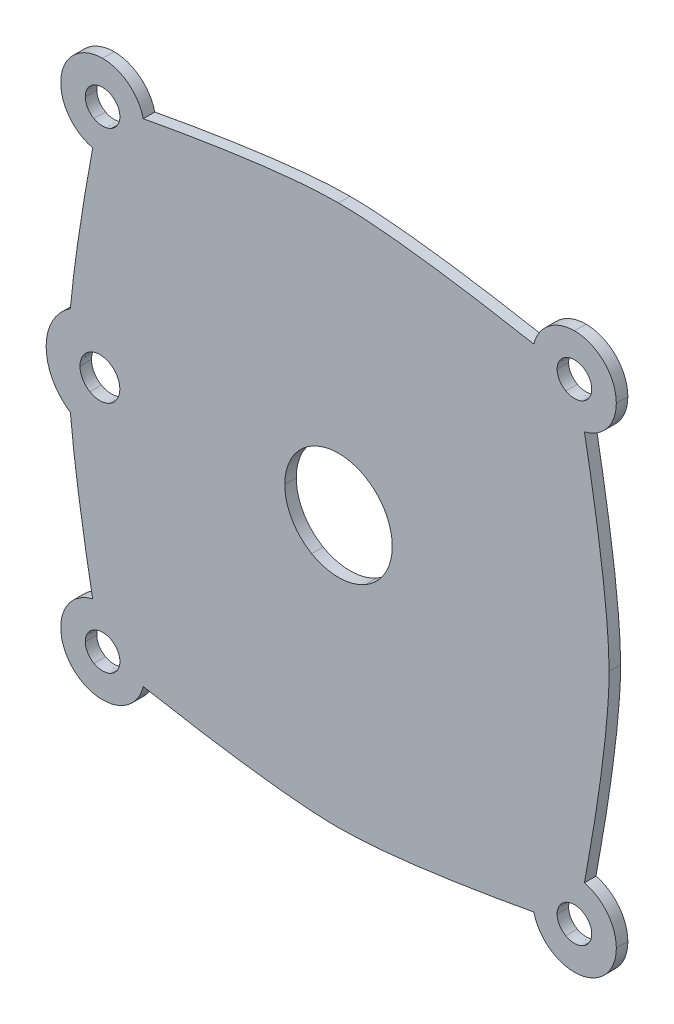
from build123d import *

# Parameters (mm, degrees)
BOSS_EXTRUDE1_DEPTH = 1.5875


with BuildPart() as part:
    # Model → Boss-Extrude1 (new body)
    with BuildSketch(Plane.XY):
        with BuildLine():
            add(Edge.make_bspline(
                [(51.355625, 215.675903), (48.170397, 215.675903), (45.587708, 213.093214), (45.587708, 209.907986)],
                knots=[0, 0, 0, 0, 1, 1, 1, 1], degree=3))
            add(Edge.make_bspline(
                [(45.587708, 209.907986), (45.587708, 207.192636), (47.461661, 204.920366), (49.988611, 204.307639)],
                knots=[0, 0, 0, 0, 1, 1, 1, 1], degree=3))
            add(Edge.make_bspline(
                [(49.988611, 204.307639), (48.973952, 198.860581), (47.546613, 190.540568), (46.910625, 183.581944)],
                knots=[0, 0, 0, 0, 1, 1, 1, 1], degree=3))
            add(Edge.make_bspline(
                [(46.910625, 183.581944), (44.902013, 182.25747), (43.576875, 179.985474), (43.576875, 177.399514)],
                knots=[0, 0, 0, 0, 1, 1, 1, 1], degree=3))
            add(Edge.make_bspline(
                [(43.576875, 177.399514), (43.576875, 174.813554), (44.902013, 172.532738), (46.910625, 171.208264)],
                knots=[0, 0, 0, 0, 1, 1, 1, 1], degree=3))
            add(Edge.make_bspline(
                [(46.910625, 171.208264), (47.544341, 164.25069), (48.96575, 155.940084), (49.979792, 150.491389)],
                knots=[0, 0, 0, 0, 1, 1, 1, 1], degree=3))
            add(Edge.make_bspline(
                [(49.979792, 150.491389), (47.456739, 149.875899), (45.587708, 147.603626), (45.587708, 144.891042)],
                knots=[0, 0, 0, 0, 1, 1, 1, 1], degree=3))
            add(Edge.make_bspline(
                [(45.587708, 144.891042), (45.587708, 141.705814), (48.170397, 139.123125), (51.355625, 139.123125)],
                knots=[0, 0, 0, 0, 1, 1, 1, 1], degree=3))
            add(Edge.make_bspline(
                [(51.355625, 139.123125), (54.06821, 139.123125), (56.340482, 140.992156), (56.955972, 143.515208)],
                knots=[0, 0, 0, 0, 1, 1, 1, 1], degree=3))
            add(Edge.make_bspline(
                [(56.955972, 143.515208), (64.168065, 142.172988), (76.405904, 140.119722), (83.864097, 140.119722)],
                knots=[0, 0, 0, 0, 1, 1, 1, 1], degree=3))
            add(Edge.make_bspline(
                [(83.864097, 140.119722), (91.322294, 140.119722), (103.560129, 142.172988), (110.772222, 143.515208)],
                knots=[0, 0, 0, 0, 1, 1, 1, 1], degree=3))
            add(Edge.make_bspline(
                [(110.772222, 143.515208), (111.387873, 140.992384), (113.660149, 139.123125), (116.372569, 139.123125)],
                knots=[0, 0, 0, 0, 1, 1, 1, 1], degree=3))
            add(Edge.make_bspline(
                [(116.372569, 139.123125), (119.557797, 139.123125), (122.140486, 141.705814), (122.140486, 144.891042)],
                knots=[0, 0, 0, 0, 1, 1, 1, 1], degree=3))
            add(Edge.make_bspline(
                [(122.140486, 144.891042), (122.140486, 147.601343), (120.268238, 149.87363), (117.748403, 150.491389)],
                knots=[0, 0, 0, 0, 1, 1, 1, 1], degree=3))
            add(Edge.make_bspline(
                [(117.748403, 150.491389), (119.090623, 157.703482), (121.143889, 169.941318), (121.143889, 177.399514)],
                knots=[0, 0, 0, 0, 1, 1, 1, 1], degree=3))
            add(Edge.make_bspline(
                [(121.143889, 177.399514), (121.143889, 184.85771), (119.090623, 197.095546), (117.748403, 204.307639)],
                knots=[0, 0, 0, 0, 1, 1, 1, 1], degree=3))
            add(Edge.make_bspline(
                [(117.748403, 204.307639), (120.268043, 204.925536), (122.140486, 207.197823), (122.140486, 209.907986)],
                knots=[0, 0, 0, 0, 1, 1, 1, 1], degree=3))
            add(Edge.make_bspline(
                [(122.140486, 209.907986), (122.140486, 213.093214), (119.557797, 215.675903), (116.372569, 215.675903)],
                knots=[0, 0, 0, 0, 1, 1, 1, 1], degree=3))
            add(Edge.make_bspline(
                [(116.372569, 215.675903), (113.662406, 215.675903), (111.39012, 213.80346), (110.772222, 211.283819)],
                knots=[0, 0, 0, 0, 1, 1, 1, 1], degree=3))
            add(Edge.make_bspline(
                [(110.772222, 211.283819), (103.560129, 212.62604), (91.322294, 214.679306), (83.864097, 214.679306)],
                knots=[0, 0, 0, 0, 1, 1, 1, 1], degree=3))
            add(Edge.make_bspline(
                [(83.864097, 214.679306), (76.404414, 214.679306), (64.16677, 212.618076), (56.955972, 211.275)],
                knots=[0, 0, 0, 0, 1, 1, 1, 1], degree=3))
            add(Edge.make_bspline(
                [(56.955972, 211.275), (56.341256, 213.799142), (54.068983, 215.675903), (51.355625, 215.675903)],
                knots=[0, 0, 0, 0, 1, 1, 1, 1], degree=3))
        make_face()
        with BuildLine():
            add(Edge.make_bspline(
                [(53.73559, 209.904656), (53.73559, 209.079821), (53.28086, 208.317642), (52.542694, 207.905225)],
                knots=[0, 0, 0, 0, 1, 1, 1, 1], degree=3))
            add(Edge.make_bspline(
                [(52.542694, 207.905225), (51.804528, 207.492808), (50.895069, 207.492808), (50.156903, 207.905225)],
                knots=[0, 0, 0, 0, 1, 1, 1, 1], degree=3))
            add(Edge.make_bspline(
                [(50.156903, 207.905225), (49.418737, 208.317642), (48.964008, 209.079821), (48.964008, 209.904656)],
                knots=[0, 0, 0, 0, 1, 1, 1, 1], degree=3))
            add(Edge.make_bspline(
                [(48.964008, 209.904656), (48.964008, 210.729491), (49.418737, 211.49167), (50.156903, 211.904087)],
                knots=[0, 0, 0, 0, 1, 1, 1, 1], degree=3))
            add(Edge.make_bspline(
                [(50.156903, 211.904087), (50.895069, 212.316505), (51.804528, 212.316505), (52.542694, 211.904087)],
                knots=[0, 0, 0, 0, 1, 1, 1, 1], degree=3))
            add(Edge.make_bspline(
                [(52.542694, 211.904087), (53.28086, 211.49167), (53.73559, 210.729491), (53.73559, 209.904656)],
                knots=[0, 0, 0, 0, 1, 1, 1, 1], degree=3))
        make_face(mode=Mode.SUBTRACT)
        with BuildLine():
            add(Edge.make_bspline(
                [(118.754103, 144.88614), (118.754103, 144.061305), (118.299374, 143.299126), (117.561208, 142.886709)],
                knots=[0, 0, 0, 0, 1, 1, 1, 1], degree=3))
            add(Edge.make_bspline(
                [(117.561208, 142.886709), (116.823041, 142.474291), (115.913583, 142.474291), (115.175417, 142.886709)],
                knots=[0, 0, 0, 0, 1, 1, 1, 1], degree=3))
            add(Edge.make_bspline(
                [(115.175417, 142.886709), (114.437251, 143.299126), (113.982521, 144.061305), (113.982521, 144.88614)],
                knots=[0, 0, 0, 0, 1, 1, 1, 1], degree=3))
            add(Edge.make_bspline(
                [(113.982521, 144.88614), (113.982521, 145.710975), (114.437251, 146.473153), (115.175417, 146.885571)],
                knots=[0, 0, 0, 0, 1, 1, 1, 1], degree=3))
            add(Edge.make_bspline(
                [(115.175417, 146.885571), (115.913583, 147.297988), (116.823041, 147.297988), (117.561208, 146.885571)],
                knots=[0, 0, 0, 0, 1, 1, 1, 1], degree=3))
            add(Edge.make_bspline(
                [(117.561208, 146.885571), (118.299374, 146.473153), (118.754103, 145.710975), (118.754103, 144.88614)],
                knots=[0, 0, 0, 0, 1, 1, 1, 1], degree=3))
        make_face(mode=Mode.SUBTRACT)
        with BuildLine():
            add(Edge.make_bspline(
                [(53.73559, 144.88614), (53.73559, 144.061305), (53.28086, 143.299126), (52.542694, 142.886709)],
                knots=[0, 0, 0, 0, 1, 1, 1, 1], degree=3))
            add(Edge.make_bspline(
                [(52.542694, 142.886709), (51.804528, 142.474291), (50.895069, 142.474291), (50.156903, 142.886709)],
                knots=[0, 0, 0, 0, 1, 1, 1, 1], degree=3))
            add(Edge.make_bspline(
                [(50.156903, 142.886709), (49.418737, 143.299126), (48.964008, 144.061305), (48.964008, 144.88614)],
                knots=[0, 0, 0, 0, 1, 1, 1, 1], degree=3))
            add(Edge.make_bspline(
                [(48.964008, 144.88614), (48.964008, 145.710975), (49.418737, 146.473153), (50.156903, 146.885571)],
                knots=[0, 0, 0, 0, 1, 1, 1, 1], degree=3))
            add(Edge.make_bspline(
                [(50.156903, 146.885571), (50.895069, 147.297988), (51.804528, 147.297988), (52.542694, 146.885571)],
                knots=[0, 0, 0, 0, 1, 1, 1, 1], degree=3))
            add(Edge.make_bspline(
                [(52.542694, 146.885571), (53.28086, 146.473153), (53.73559, 145.710975), (53.73559, 144.88614)],
                knots=[0, 0, 0, 0, 1, 1, 1, 1], degree=3))
        make_face(mode=Mode.SUBTRACT)
        with BuildLine():
            add(Edge.make_bspline(
                [(118.754103, 209.904653), (118.754103, 209.079818), (118.299374, 208.31764), (117.561208, 207.905222)],
                knots=[0, 0, 0, 0, 1, 1, 1, 1], degree=3))
            add(Edge.make_bspline(
                [(117.561208, 207.905222), (116.823041, 207.492805), (115.913583, 207.492805), (115.175417, 207.905222)],
                knots=[0, 0, 0, 0, 1, 1, 1, 1], degree=3))
            add(Edge.make_bspline(
                [(115.175417, 207.905222), (114.437251, 208.31764), (113.982521, 209.079818), (113.982521, 209.904653)],
                knots=[0, 0, 0, 0, 1, 1, 1, 1], degree=3))
            add(Edge.make_bspline(
                [(113.982521, 209.904653), (113.982521, 210.729488), (114.437251, 211.491667), (115.175417, 211.904084)],
                knots=[0, 0, 0, 0, 1, 1, 1, 1], degree=3))
            add(Edge.make_bspline(
                [(115.175417, 211.904084), (115.913583, 212.316502), (116.823041, 212.316502), (117.561208, 211.904084)],
                knots=[0, 0, 0, 0, 1, 1, 1, 1], degree=3))
            add(Edge.make_bspline(
                [(117.561208, 211.904084), (118.299374, 211.491667), (118.754103, 210.729488), (118.754103, 209.904653)],
                knots=[0, 0, 0, 0, 1, 1, 1, 1], degree=3))
        make_face(mode=Mode.SUBTRACT)
        with BuildLine():
            add(Edge.make_bspline(
                [(53.725135, 177.395399), (53.725794, 176.41473), (53.202992, 175.508272), (52.353818, 175.017747)],
                knots=[0, 0, 0, 0, 1, 1, 1, 1], degree=3))
            add(Edge.make_bspline(
                [(52.353818, 175.017747), (51.504643, 174.527222), (50.458227, 174.527222), (49.609052, 175.017747)],
                knots=[0, 0, 0, 0, 1, 1, 1, 1], degree=3))
            add(Edge.make_bspline(
                [(49.609052, 175.017747), (48.759878, 175.508272), (48.237076, 176.41473), (48.237735, 177.395399)],
                knots=[0, 0, 0, 0, 1, 1, 1, 1], degree=3))
            add(Edge.make_bspline(
                [(48.237735, 177.395399), (48.237076, 178.376068), (48.759878, 179.282526), (49.609052, 179.773051)],
                knots=[0, 0, 0, 0, 1, 1, 1, 1], degree=3))
            add(Edge.make_bspline(
                [(49.609052, 179.773051), (50.458227, 180.263576), (51.504643, 180.263576), (52.353818, 179.773051)],
                knots=[0, 0, 0, 0, 1, 1, 1, 1], degree=3))
            add(Edge.make_bspline(
                [(52.353818, 179.773051), (53.202992, 179.282526), (53.725794, 178.376068), (53.725135, 177.395399)],
                knots=[0, 0, 0, 0, 1, 1, 1, 1], degree=3))
        make_face(mode=Mode.SUBTRACT)
        with BuildLine():
            add(Edge.make_bspline(
                [(91.264482, 177.395404), (91.266263, 174.748514), (89.855187, 172.301924), (87.563209, 170.977965)],
                knots=[0, 0, 0, 0, 1, 1, 1, 1], degree=3))
            add(Edge.make_bspline(
                [(87.563209, 170.977965), (85.271231, 169.654005), (82.446884, 169.654005), (80.154906, 170.977965)],
                knots=[0, 0, 0, 0, 1, 1, 1, 1], degree=3))
            add(Edge.make_bspline(
                [(80.154906, 170.977965), (77.862928, 172.301924), (76.451852, 174.748514), (76.453632, 177.395404)],
                knots=[0, 0, 0, 0, 1, 1, 1, 1], degree=3))
            add(Edge.make_bspline(
                [(76.453632, 177.395404), (76.451852, 180.042294), (77.862928, 182.488884), (80.154906, 183.812843)],
                knots=[0, 0, 0, 0, 1, 1, 1, 1], degree=3))
            add(Edge.make_bspline(
                [(80.154906, 183.812843), (82.446884, 185.136802), (85.271231, 185.136802), (87.563209, 183.812843)],
                knots=[0, 0, 0, 0, 1, 1, 1, 1], degree=3))
            add(Edge.make_bspline(
                [(87.563209, 183.812843), (89.855187, 182.488884), (91.266263, 180.042294), (91.264482, 177.395404)],
                knots=[0, 0, 0, 0, 1, 1, 1, 1], degree=3))
        make_face(mode=Mode.SUBTRACT)
    extrude(amount=BOSS_EXTRUDE1_DEPTH)


solid = part.part
